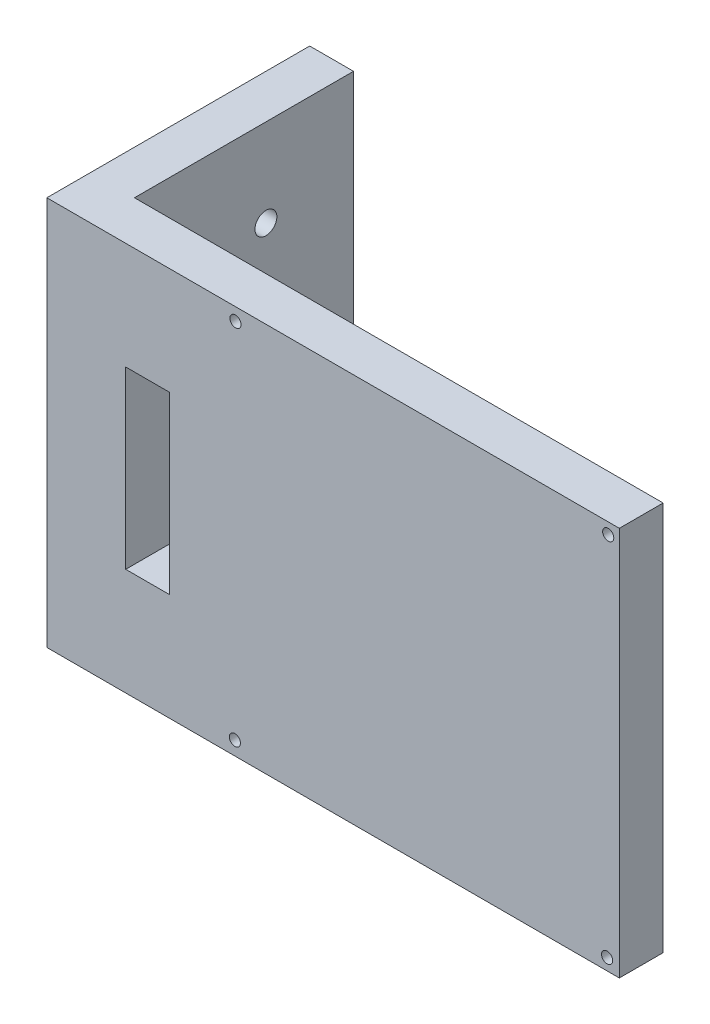
from build123d import *

# Parameters (mm, degrees)
SKETCH1_W           = 90.678
SKETCH1_H           = 88.9
SKETCH1_R           = 1.27
BOSS_EXTRUDE1_DEPTH = 10
SKETCH2_W           = 10
SKETCH2_H           = 88.9
BOSS_EXTRUDE2_DEPTH = 30
SKETCH5_W           = 10
SKETCH5_H           = 40
CUT_EXTRUDE1_DEPTH  = 10
SKETCH7_W           = 60
SKETCH7_H           = 88.9
BOSS_EXTRUDE3_DEPTH = 10
SKETCH8_R           = 2.5
CUT_EXTRUDE2_DEPTH  = 10


with BuildPart() as part:
    # Sketch1 → Boss-Extrude1 (new body)
    with BuildSketch(Plane.XY):
        with Locations((45.339, 44.45)):
            Rectangle(SKETCH1_W, SKETCH1_H)
        with Locations((2.921, 3.175)):
            Circle(SKETCH1_R, mode=Mode.SUBTRACT)
        with Locations((3.048, 85.979)):
            Circle(SKETCH1_R, mode=Mode.SUBTRACT)
        with Locations((87.884, 2.667)):
            Circle(SKETCH1_R, mode=Mode.SUBTRACT)
        with Locations((88.138, 86.36)):
            Circle(SKETCH1_R, mode=Mode.SUBTRACT)
    extrude(amount=BOSS_EXTRUDE1_DEPTH)

    # Sketch2 → Boss-Extrude2 (add)
    with BuildSketch(Plane.ZY):
        with Locations((5, 44.45)):
            Rectangle(SKETCH2_W, SKETCH2_H)
    extrude(amount=BOSS_EXTRUDE2_DEPTH)

    # Sketch5 → Cut-Extrude1 (cut)
    with BuildSketch(Plane.XY.offset(10)):
        with Locations((-17, 44.45)):
            Rectangle(SKETCH5_W, SKETCH5_H)
    extrude(amount=-CUT_EXTRUDE1_DEPTH, mode=Mode.SUBTRACT)

    # Sketch7 → Boss-Extrude3 (add)
    with BuildSketch(Plane.ZY.offset(30)):
        with Locations((-20, 44.45)):
            Rectangle(SKETCH7_W, SKETCH7_H)
    extrude(amount=BOSS_EXTRUDE3_DEPTH)

    # Sketch8 → Cut-Extrude2 (cut)
    with BuildSketch(Plane.ZY.offset(40)):
        with Locations((-10, 68.9)):
            Circle(SKETCH8_R)
        with Locations(Location((-10, 20, 0), (0, 0, 180))):
            Circle(SKETCH8_R)
        with Locations((-30, 20)):
            Circle(SKETCH8_R)
        with Locations(Location((-30, 68.9, 0), (0, 0, 180))):
            Circle(SKETCH8_R)
    extrude(amount=-CUT_EXTRUDE2_DEPTH, mode=Mode.SUBTRACT)


solid = part.part
